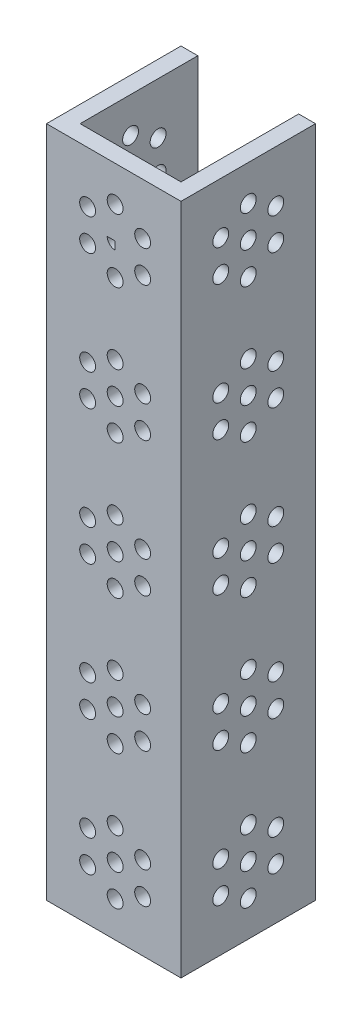
from build123d import *

# Parameters (mm, degrees)
BOSS_EXTRUDE1_DEPTH = 127
SKETCH3_R           = 1.5
CUT_EXTRUDE1_DEPTH  = 132.982271537
SKETCH4_R           = 1.5
CUT_EXTRUDE2_DEPTH  = 10


with BuildPart() as part:
    # Sketch2 → Boss-Extrude1 (new body)
    with BuildSketch(Plane(origin=(0, 0, 0), x_dir=(1, 0, 0), z_dir=(0, 1, 0))):
        Polygon((22.225, 3.175), (12.7, 3.175), (3.175, 3.175), (3.175, 25.4), (0, 25.4), (0, 0), (25.4, 0), (25.4, 25.4), (22.225, 25.4), align=None)
    extrude(amount=BOSS_EXTRUDE1_DEPTH)

    # Sketch3 → Cut-Extrude1 (cut, through all)
    with BuildSketch(Plane.ZY):
        with Locations((-17.896152423, 9.7)):
            Circle(SKETCH3_R)
        with Locations((-17.896152423, 15.7)):
            Circle(SKETCH3_R)
        with Locations((-12.7, 18.7)):
            Circle(SKETCH3_R)
        with Locations((-12.7, 12.7)):
            Circle(SKETCH3_R)
        with Locations((-12.7, 6.7)):
            Circle(SKETCH3_R)
        with Locations((-7.503847577, 9.7)):
            Circle(SKETCH3_R)
        with Locations((-7.503847577, 15.7)):
            Circle(SKETCH3_R)
        with Locations((-17.896152423, 35.1)):
            Circle(SKETCH3_R)
        with Locations((-17.896152423, 41.1)):
            Circle(SKETCH3_R)
        with Locations((-12.7, 44.1)):
            Circle(SKETCH3_R)
        with Locations((-12.7, 38.1)):
            Circle(SKETCH3_R)
        with Locations((-7.503847577, 35.1)):
            Circle(SKETCH3_R)
        with Locations((-7.503847577, 41.1)):
            Circle(SKETCH3_R)
        with Locations((-12.7, 57.5)):
            Circle(SKETCH3_R)
        with Locations((-12.7, 63.5)):
            Circle(SKETCH3_R)
        with Locations((-12.7, 32.1)):
            Circle(SKETCH3_R)
        with Locations((-17.896152423, 60.5)):
            Circle(SKETCH3_R)
        with Locations((-17.896152423, 66.5)):
            Circle(SKETCH3_R)
        with Locations((-12.7, 69.5)):
            Circle(SKETCH3_R)
        with Locations((-7.503847577, 66.5)):
            Circle(SKETCH3_R)
        with Locations((-7.503847577, 60.5)):
            Circle(SKETCH3_R)
        with Locations((-17.896152423, 85.9)):
            Circle(SKETCH3_R)
        with Locations((-17.896152423, 91.9)):
            Circle(SKETCH3_R)
        with Locations((-12.7, 82.9)):
            Circle(SKETCH3_R)
        with Locations((-12.7, 88.9)):
            Circle(SKETCH3_R)
        with Locations((-7.503847577, 85.9)):
            Circle(SKETCH3_R)
        with Locations((-7.503847577, 91.9)):
            Circle(SKETCH3_R)
        with Locations((-12.7, 94.9)):
            Circle(SKETCH3_R)
        with Locations((-17.896152423, 111.3)):
            Circle(SKETCH3_R)
        with Locations((-12.7, 108.3)):
            Circle(SKETCH3_R)
        with Locations((-17.896152423, 117.3)):
            Circle(SKETCH3_R)
        with Locations((-12.7, 120.3)):
            Circle(SKETCH3_R)
        with Locations((-12.7, 114.3)):
            Circle(SKETCH3_R)
        with Locations((-7.503847577, 111.3)):
            Circle(SKETCH3_R)
        with Locations((-7.503847577, 117.3)):
            Circle(SKETCH3_R)
    extrude(amount=-CUT_EXTRUDE1_DEPTH, mode=Mode.SUBTRACT)

    # Sketch4 → Cut-Extrude2 (cut)
    with BuildSketch(Plane.XY):
        with BuildLine():
            Line((12.963682416, 112.8), (12.963682416, 114.3))
            Line((12.963682416, 114.3), (11.463682416, 114.3))
            ThreePointArc((11.463682416, 114.3), (11.903022244, 113.239339828), (12.963682416, 112.8))
        make_face()
        with Locations((12.963682416, 108.3)):
            Circle(SKETCH4_R)
        with Locations((7.767529993, 111.3)):
            Circle(SKETCH4_R)
        with Locations((7.767529993, 117.3)):
            Circle(SKETCH4_R)
        with Locations((12.963682416, 120.3)):
            Circle(SKETCH4_R)
        with Locations((18.159834839, 117.3)):
            Circle(SKETCH4_R)
        with Locations((18.159834839, 111.3)):
            Circle(SKETCH4_R)
        with Locations((12.963682416, 82.9)):
            Circle(SKETCH4_R)
        with Locations((12.963682416, 88.9)):
            Circle(SKETCH4_R)
        with Locations((12.963682416, 94.9)):
            Circle(SKETCH4_R)
        with Locations((18.159834839, 91.9)):
            Circle(SKETCH4_R)
        with Locations((18.159834839, 85.9)):
            Circle(SKETCH4_R)
        with Locations((7.767529993, 91.9)):
            Circle(SKETCH4_R)
        with Locations((7.767529993, 85.9)):
            Circle(SKETCH4_R)
        with Locations((12.963682416, 57.5)):
            Circle(SKETCH4_R)
        with Locations((12.963682416, 63.5)):
            Circle(SKETCH4_R)
        with Locations((12.963682416, 69.5)):
            Circle(SKETCH4_R)
        with Locations((18.159834839, 66.5)):
            Circle(SKETCH4_R)
        with Locations((18.159834839, 60.5)):
            Circle(SKETCH4_R)
        with Locations((7.767529993, 66.5)):
            Circle(SKETCH4_R)
        with Locations((7.767529993, 60.5)):
            Circle(SKETCH4_R)
        with Locations((12.963682416, 32.1)):
            Circle(SKETCH4_R)
        with Locations((12.963682416, 38.1)):
            Circle(SKETCH4_R)
        with Locations((12.963682416, 44.1)):
            Circle(SKETCH4_R)
        with Locations((18.159834839, 41.1)):
            Circle(SKETCH4_R)
        with Locations((18.159834839, 35.1)):
            Circle(SKETCH4_R)
        with Locations((7.767529993, 41.1)):
            Circle(SKETCH4_R)
        with Locations((7.767529993, 35.1)):
            Circle(SKETCH4_R)
        with Locations((12.963682416, 6.7)):
            Circle(SKETCH4_R)
        with Locations((12.963682416, 12.7)):
            Circle(SKETCH4_R)
        with Locations((12.963682416, 18.7)):
            Circle(SKETCH4_R)
        with Locations((18.159834839, 15.7)):
            Circle(SKETCH4_R)
        with Locations((18.159834839, 9.7)):
            Circle(SKETCH4_R)
        with Locations((7.767529993, 15.7)):
            Circle(SKETCH4_R)
        with Locations((7.767529993, 9.7)):
            Circle(SKETCH4_R)
    extrude(amount=-CUT_EXTRUDE2_DEPTH, mode=Mode.SUBTRACT)


solid = part.part
